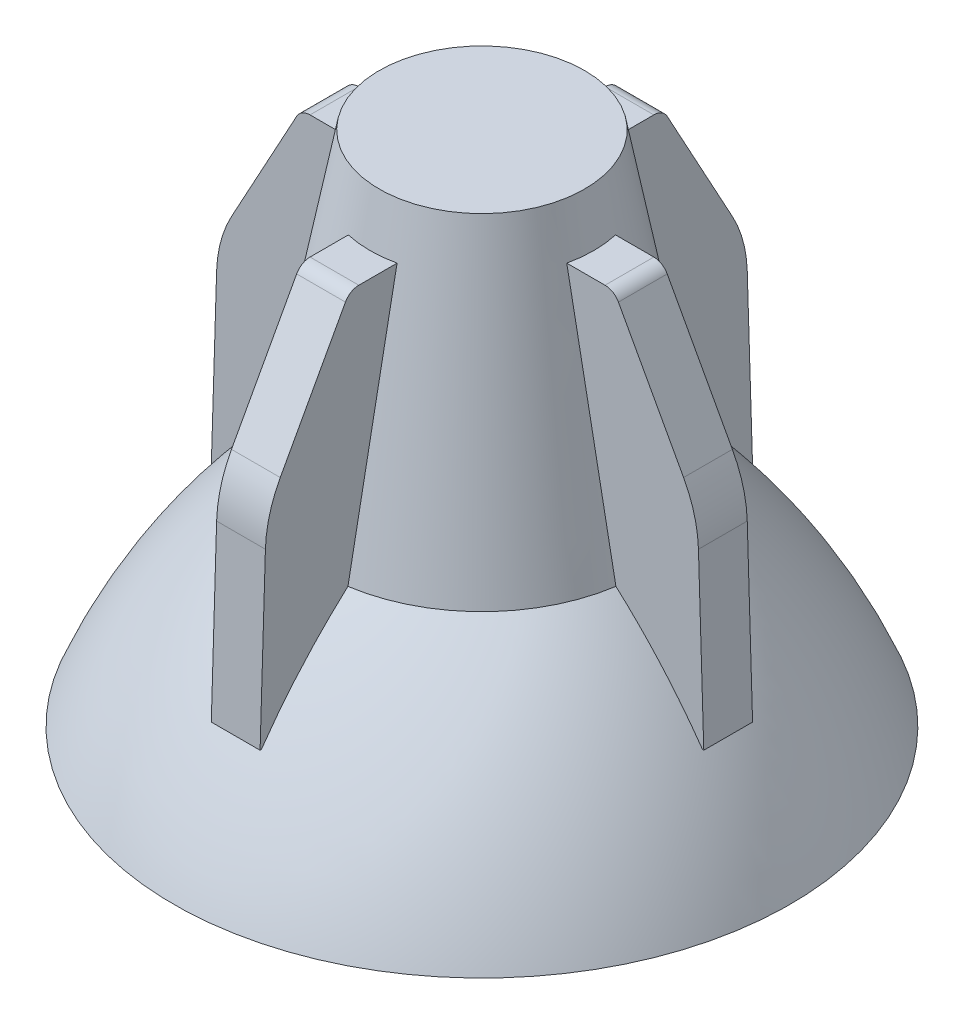
from build123d import *

# Parameters (mm, degrees)
EXTRUDE7_DEPTH    = 5.08
CIRPATTERN1_COUNT = 4


with BuildPart() as part:
    # Sketch9 → Revolve3 (revolve)
    with BuildSketch(Plane.XY):
        with BuildLine():
            Line((182.533079755, 194.292434626), (161.142350377, 194.292434626))
            Line((161.142350377, 194.292434626), (161.142350377, 86.698034626))
            Line((161.142350377, 86.698034626), (225.334809451, 86.698034626))
            ThreePointArc((225.334809451, 86.698034626), (212.420274366, 110.575127951), (194.511888207, 130.975875666))
            Line((194.511888207, 130.975875666), (182.533079755, 194.292434626))
        make_face()
    revolve(axis=Axis((161.142350377, 86.698034626, 0), (0, 1, 0)))

    # Sketch10 → Extrude7 (add, symmetric)
    with BuildSketch(Plane.XY):
        with BuildLine():
            Line((161.142350377, 110.575127951), (161.142350377, 184.160379168))
            Line((161.142350377, 184.160379168), (191.859109399, 184.160379168))
            ThreePointArc((191.859109399, 184.160379168), (193.479127486, 183.715977344), (194.645640696, 182.507176898))
            Line((194.645640696, 182.507176898), (208.216170429, 157.658469957))
            ThreePointArc((208.216170429, 157.658469957), (210.434241625, 152.147730999), (211.311680607, 146.272513171))
            Line((211.311680607, 146.272513171), (212.420274366, 110.575127951))
            Line((212.420274366, 110.575127951), (161.142350377, 110.575127951))
        make_face()
    extrude7 = extrude(amount=EXTRUDE7_DEPTH, both=True)

    # CirPattern1: Extrude7 ×4 about axis
    cirpattern1_axis = Axis((161.142350377, 130.975875666, 0), (0, 1, 0))
    for i in range(1, CIRPATTERN1_COUNT):
        add(extrude7.rotate(cirpattern1_axis, i * 360 / CIRPATTERN1_COUNT))


solid = part.part
